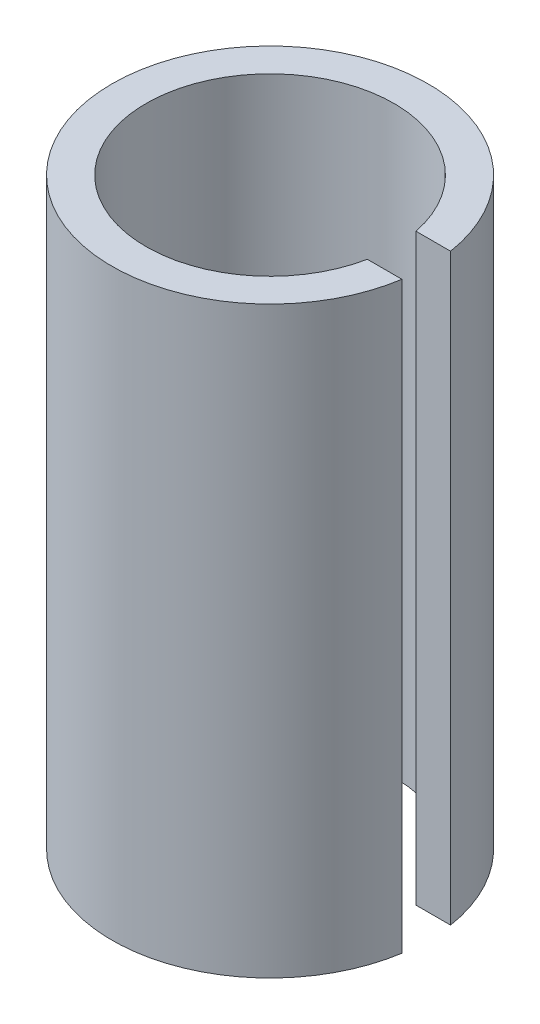
from build123d import *

# Parameters (mm, degrees)
BOSS_EXTRUDE1_DEPTH = 12


with BuildPart() as part:
    # Sketch1 → Boss-Extrude1 (new body)
    with BuildSketch(Plane(origin=(0, 0, 0), x_dir=(1, 0, 0), z_dir=(0, 1, 0))):
        with BuildLine():
            ThreePointArc((2.50049995, -0.5), (-2.55, 0), (2.50049995, 0.5))
            Line((2.50049995, 0.5), (3.211308145, 0.5))
            ThreePointArc((3.211308145, 0.5), (-3.25, 0), (3.211308145, -0.5))
            Line((3.211308145, -0.5), (2.50049995, -0.5))
        make_face()
    extrude(amount=BOSS_EXTRUDE1_DEPTH)


solid = part.part
